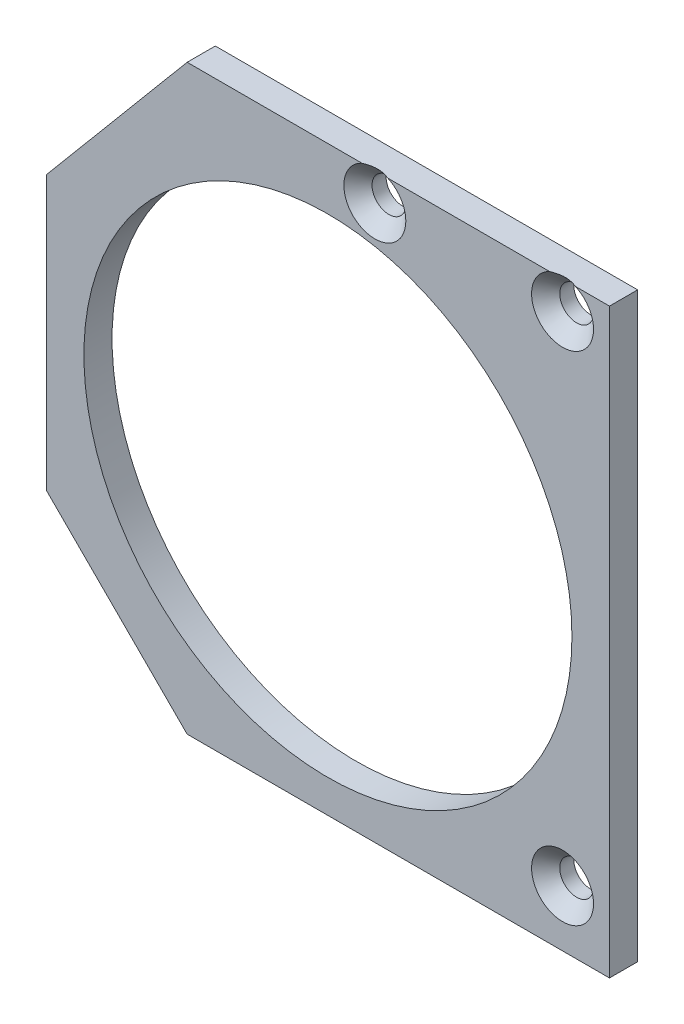
from build123d import *

# Parameters (mm, degrees)
SKETCH_1_W                  = 60
SKETCH_1_H                  = 62
SKETCH_1_R                  = 26
SKETCH_1_R_2                = 1.6
EXTRUDE_1_DEPTH             = 3
CUT_EXTRUDE_1_DEPTH         = 44.243496621
CUT_EXTRUDE_2_REACH         = 45.243
SKETCH_5_R                  = 1.6
CUT_EXTRUDE_3_DEPTH         = 44.243496621
HOLE_WIZARD_M3_1_AT_2_COUNT = 2
HOLE_WIZARD_M3_1_AT_2_PITCH = 20
HOLE_WIZARD_M3_1_AT_3_COUNT = 2
HOLE_WIZARD_M3_1_AT_3_PITCH = 56.648036153


with BuildPart() as part:
    # 草图1 → 凸台-拉伸1 (new body)
    with BuildSketch(Plane.XY):
        Rectangle(SKETCH_1_W, SKETCH_1_H)
        with Locations((0, -1.5)):
            Circle(SKETCH_1_R, mode=Mode.SUBTRACT)
        with Locations((25, 28)):
            Circle(SKETCH_1_R_2, mode=Mode.SUBTRACT)
        with Locations((5, 28)):
            Circle(SKETCH_1_R_2, mode=Mode.SUBTRACT)
    extrude(amount=EXTRUDE_1_DEPTH)

    # 草图2 → 切除-拉伸1 (cut, through all)
    with BuildSketch(Plane.XY.offset(3)):
        Polygon((-30, 13.123696111), (-15, 31), (-30, 31), align=None)
    extrude(amount=-CUT_EXTRUDE_1_DEPTH, mode=Mode.SUBTRACT)

    # 草图4 → 切除-拉伸2 (cut, up to next)
    with BuildSketch(Plane.XY.offset(3), mode=Mode.PRIVATE) as cut_extrude_2_sk1:
        Polygon((-30, -16), (-15, -31), (-30, -31), align=None)
    cut_extrude_2_tool1 = extrude(cut_extrude_2_sk1.sketch, amount=-CUT_EXTRUDE_2_REACH, mode=Mode.PRIVATE) & part.part
    add(cut_extrude_2_tool1.solids().sort_by_distance((-25, -26, 3))[0], mode=Mode.SUBTRACT)

    # 草图5 → 切除-拉伸3 (cut, through all)
    with BuildSketch(Plane.XY.offset(3)):
        with Locations((25, -25)):
            Circle(SKETCH_5_R)
    extrude(amount=-CUT_EXTRUDE_3_DEPTH, mode=Mode.SUBTRACT)

    # 草图7 → M3 十字槽半沉头木螺钉的锥形沉头孔1 (revolve, cut)
    with BuildSketch(Plane(origin=(5, 28, 3), x_dir=(0, -1, 0), z_dir=(1, 0, 0))):
        Polygon((0, 0), (0, 3), (1.8, 3), (1.8, 1.5), (3.3, 0), align=None)
    hole_wizard_m3_1 = revolve(axis=Axis((5, 28, 9.35), (0, 0, -1)), mode=Mode.SUBTRACT)

    # M3 十字槽半沉头木螺钉的锥形沉头孔1 at 2: M3 十字槽半沉头木螺钉的锥形沉头孔1 ×2
    with Locations(*[(i * HOLE_WIZARD_M3_1_AT_2_PITCH, 0, 0) for i in range(1, HOLE_WIZARD_M3_1_AT_2_COUNT)]):
        add(hole_wizard_m3_1, mode=Mode.SUBTRACT)

    # M3 十字槽半沉头木螺钉的锥形沉头孔1 at 3: M3 十字槽半沉头木螺钉的锥形沉头孔1 ×2
    with Locations(*[Vector(0.35305725243424246, -0.9356017189507422, 0) * (i * HOLE_WIZARD_M3_1_AT_3_PITCH) for i in range(1, HOLE_WIZARD_M3_1_AT_3_COUNT)]):
        add(hole_wizard_m3_1, mode=Mode.SUBTRACT)


solid = part.part
